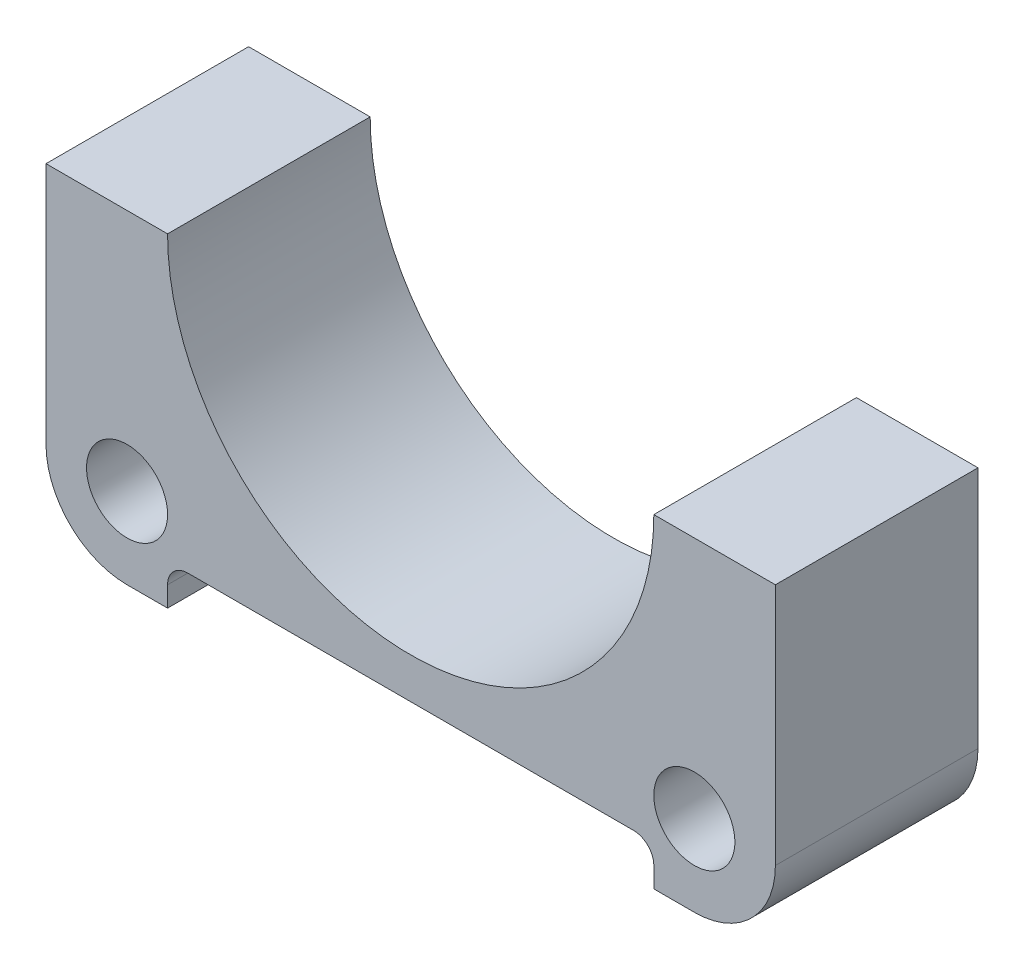
from build123d import *

# Parameters (mm, degrees)
SKETCH2_R           = 10
BOSS_EXTRUDE1_DEPTH = 50


with BuildPart() as part:
    # Sketch2 → Boss-Extrude1 (new body)
    with BuildSketch(Plane.XY):
        with BuildLine():
            Line((-60, 0), (-90, 0))
            Line((-90, 0), (-90, -7.723724189))
            Line((-90, -7.723724189), (-90, -60))
            ThreePointArc((-90, -60), (-84.142135624, -74.142135624), (-70, -80))
            Line((-70, -80), (-60, -80))
            Line((-60, -80), (-60, -75))
            ThreePointArc((-60, -75), (-58.535533906, -71.464466094), (-55, -70))
            Line((-55, -70), (55, -70))
            ThreePointArc((55, -70), (58.535533906, -71.464466094), (60, -75))
            Line((60, -75), (60, -80))
            Line((60, -80), (70, -80))
            ThreePointArc((70, -80), (84.142135624, -74.142135624), (90, -60))
            Line((90, -60), (90, -7.723724189))
            Line((90, -7.723724189), (90, 0))
            Line((90, 0), (60, 0))
            ThreePointArc((60, 0), (0, -60), (-60, 0))
        make_face()
        with Locations((-70, -60)):
            Circle(SKETCH2_R, mode=Mode.SUBTRACT)
        with Locations(Location((70, -60, 0), (0, 0, 180))):
            Circle(SKETCH2_R, mode=Mode.SUBTRACT)
    extrude(amount=BOSS_EXTRUDE1_DEPTH)


solid = part.part
